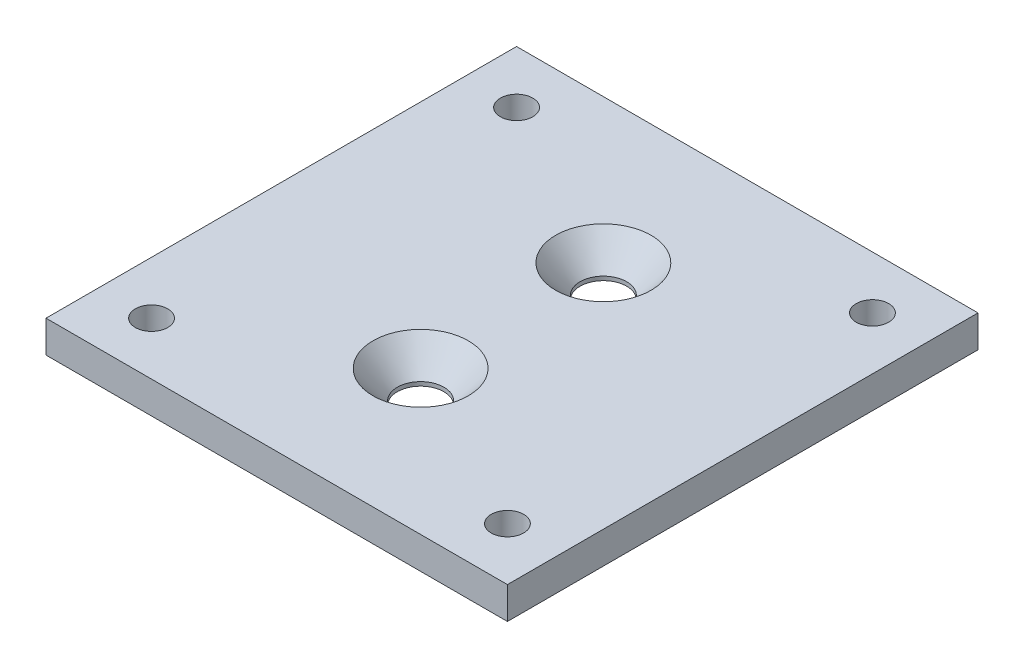
from build123d import *

# Parameters (mm, degrees)
SKETCH1_W                                   = 50.5
SKETCH1_H                                   = 51.5
SKETCH1_R                                   = 1.775
BOSS_EXTRUDE1_DEPTH                         = 3.5
CSK_FOR_10_FLAT_HEAD_SOCKET_CAP_SCR_2_COUNT = 2
CSK_FOR_10_FLAT_HEAD_SOCKET_CAP_SCR_2_PITCH = 20


with BuildPart() as part:
    # Sketch1 → Boss-Extrude1 (new body)
    with BuildSketch(Plane(origin=(0, 0, 0), x_dir=(1, 0, 0), z_dir=(0, 1, 0))):
        Rectangle(SKETCH1_W, SKETCH1_H)
        with Locations(Location((-19.475, 19.975, 0), (0, 0, 270))):
            Circle(SKETCH1_R, mode=Mode.SUBTRACT)
        with Locations(Location((19.475, 19.975, 0), (0, 0, 270))):
            Circle(SKETCH1_R, mode=Mode.SUBTRACT)
        with Locations(Location((19.475, -19.975, 0), (0, 0, 270))):
            Circle(SKETCH1_R, mode=Mode.SUBTRACT)
        with Locations(Location((-19.475, -19.975, 0), (0, 0, 270))):
            Circle(SKETCH1_R, mode=Mode.SUBTRACT)
    extrude(amount=BOSS_EXTRUDE1_DEPTH)

    # Sketch4 → CSK for #10 Flat Head Socket Cap Screw1 (revolve, cut)
    with BuildSketch(Plane(origin=(0, 3.5, -10), x_dir=(0, 0, 1), z_dir=(1, 0, 0))):
        Polygon((0, 0), (0, 3.5), (2.5527, 3.5), (2.5527, 3.068032542), (5.2197, 0), align=None)
    csk_for_10_flat_head_socket_cap_screw1 = revolve(axis=Axis((0, 9.85, -10), (0, -1, 0)), mode=Mode.SUBTRACT)

    # CSK for _10 Flat Head Socket Cap Scr 2: CSK for #10 Flat Head Socket Cap Screw1 ×2
    with Locations(*[(0, 0, i * CSK_FOR_10_FLAT_HEAD_SOCKET_CAP_SCR_2_PITCH) for i in range(1, CSK_FOR_10_FLAT_HEAD_SOCKET_CAP_SCR_2_COUNT)]):
        add(csk_for_10_flat_head_socket_cap_screw1, mode=Mode.SUBTRACT)


solid = part.part
